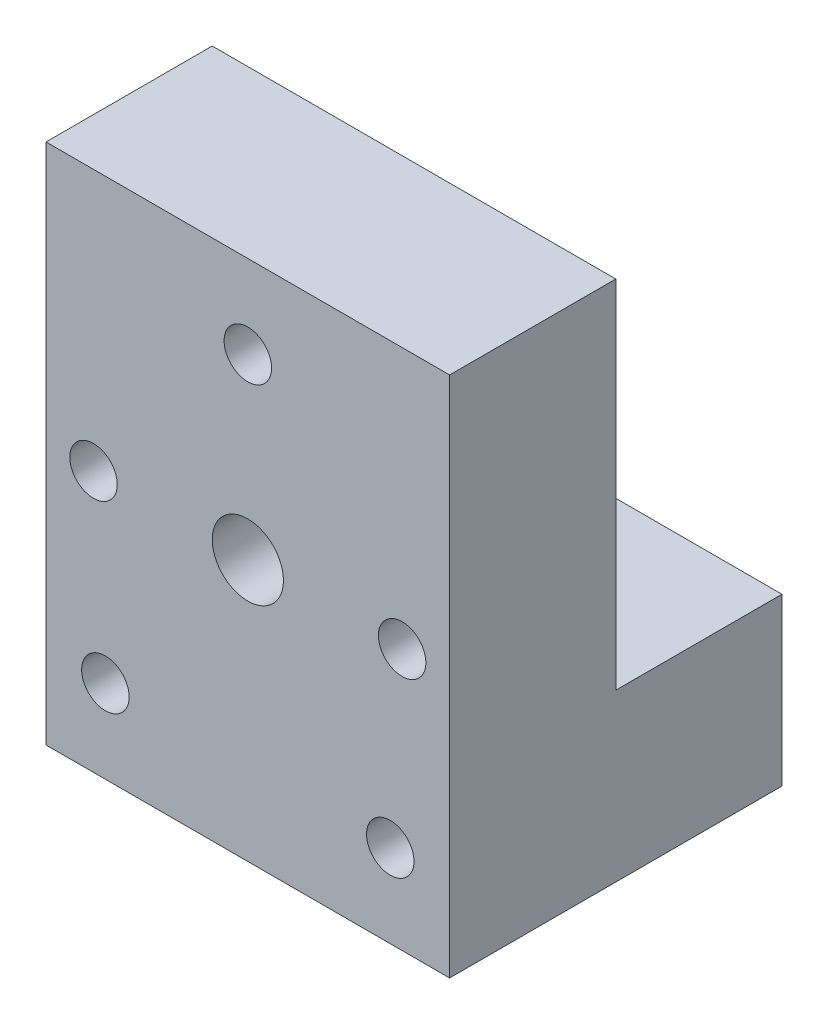
from build123d import *

# Parameters (mm, degrees)
SKETCH1_W           = 215.9
SKETCH1_H           = 101.6
SKETCH1_R           = 12.7
SKETCH1_H_2         = 88.9
BOSS_EXTRUDE1_DEPTH = 88.9
SKETCH1_3_W         = 215.9
SKETCH1_3_H         = 88.9
BOSS_EXTRUDE2_DEPTH = 88.9
SKETCH2_W           = 215.9
SKETCH2_H           = 88.9
SKETCH2_R           = 12.7
BOSS_EXTRUDE3_DEPTH = 88.9
CUT_EXTRUDE1_REACH  = 252.564
SKETCH2_3_R         = 12.7
SKETCH2_3_R_2       = 19.05


with BuildPart() as part:
    # Sketch1 → Boss-Extrude1 (new body)
    # profile 1 of 2: a face of its own
    with BuildSketch(Plane.XY):
        Rectangle(SKETCH1_W, SKETCH1_H)
        with Locations((82.55, 0)):
            Circle(SKETCH1_R, mode=Mode.SUBTRACT)
        with Locations((-82.55, 0)):
            Circle(SKETCH1_R, mode=Mode.SUBTRACT)
    # profile 2 of 2: a face of its own
    with BuildSketch(Plane.XY):
        with Locations((0, -95.25)):
            Rectangle(SKETCH1_W, SKETCH1_H_2)
    extrude(amount=BOSS_EXTRUDE1_DEPTH)

    # Sketch1<3> → Boss-Extrude2 (add)
    with BuildSketch(Plane.XY):
        with Locations((0, -95.25)):
            Rectangle(SKETCH1_3_W, SKETCH1_3_H)
    extrude(amount=-BOSS_EXTRUDE2_DEPTH)

    # Sketch2 → Boss-Extrude3 (add)
    with BuildSketch(Plane.XY.offset(88.9)):
        with Locations((0, 95.25)):
            Rectangle(SKETCH2_W, SKETCH2_H)
        with Locations((0, 95.25)):
            Circle(SKETCH2_R, mode=Mode.SUBTRACT)
    extrude(amount=-BOSS_EXTRUDE3_DEPTH)

    # Sketch2<3> → Cut-Extrude1 (cut, up to next)
    with BuildSketch(Plane.XY.offset(88.9), mode=Mode.PRIVATE) as cut_extrude1_sk1:
        with Locations((-76.2, -95.25)):
            Circle(SKETCH2_3_R)
    cut_extrude1_tool1 = extrude(cut_extrude1_sk1.sketch, amount=-CUT_EXTRUDE1_REACH, mode=Mode.PRIVATE) & part.part
    # Sketch2<3> → Cut-Extrude1 (cut, up to next)
    with BuildSketch(Plane.XY.offset(88.9), mode=Mode.PRIVATE) as cut_extrude1_sk2:
        with Locations((76.2, -95.25)):
            Circle(SKETCH2_3_R)
    cut_extrude1_tool2 = extrude(cut_extrude1_sk2.sketch, amount=-CUT_EXTRUDE1_REACH, mode=Mode.PRIVATE) & part.part
    # Sketch2<3> → Cut-Extrude1 (cut, up to next)
    with BuildSketch(Plane.XY.offset(88.9), mode=Mode.PRIVATE) as cut_extrude1_sk3:
        Circle(SKETCH2_3_R_2)
    cut_extrude1_tool3 = extrude(cut_extrude1_sk3.sketch, amount=-CUT_EXTRUDE1_REACH, mode=Mode.PRIVATE) & part.part
    add(cut_extrude1_tool1.solids().sort_by_distance((-76.2, -95.25, 88.9))[0], mode=Mode.SUBTRACT)
    add(cut_extrude1_tool2.solids().sort_by_distance((76.2, -95.25, 88.9))[0], mode=Mode.SUBTRACT)
    add(cut_extrude1_tool3.solids().sort_by_distance((0, 0, 88.9))[0], mode=Mode.SUBTRACT)


solid = part.part
